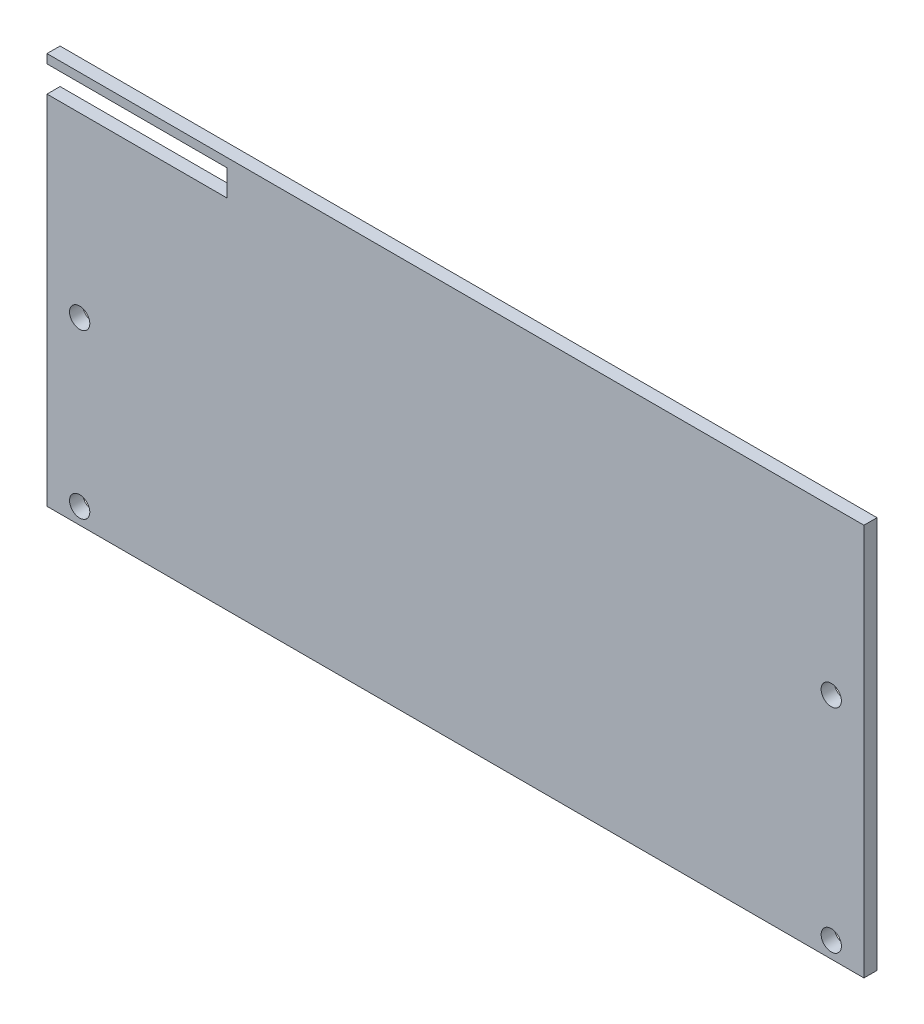
from build123d import *

# Parameters (mm, degrees)
ESQUISSE1_W             = 250
ESQUISSE1_H             = 120
ESQUISSE1_R             = 3.1
BOSS_EXTRU_1_DEPTH      = 4
ESQUISSE3_W             = 55.151458736
ESQUISSE3_H             = 8
ENL_V_MAT_EXTRU_2_DEPTH = 278.337339715


with BuildPart() as part:
    # Esquisse1 → Boss.-Extru.1 (new body)
    with BuildSketch(Plane.XY):
        with Locations((125, -60)):
            Rectangle(ESQUISSE1_W, ESQUISSE1_H)
        with Locations((10, -115)):
            Circle(ESQUISSE1_R, mode=Mode.SUBTRACT)
        with Locations((10, -65)):
            Circle(ESQUISSE1_R, mode=Mode.SUBTRACT)
        with Locations((240, -115)):
            Circle(ESQUISSE1_R, mode=Mode.SUBTRACT)
        with Locations((240, -50)):
            Circle(ESQUISSE1_R, mode=Mode.SUBTRACT)
    extrude(amount=BOSS_EXTRU_1_DEPTH)

    # Esquisse3 → Enlèv. mat.-Extru.2 (cut, through all)
    with BuildSketch(Plane.XY.offset(4)):
        with Locations((27.575729368, -6.740767181)):
            Rectangle(ESQUISSE3_W, ESQUISSE3_H)
    extrude(amount=-ENL_V_MAT_EXTRU_2_DEPTH, mode=Mode.SUBTRACT)


solid = part.part
